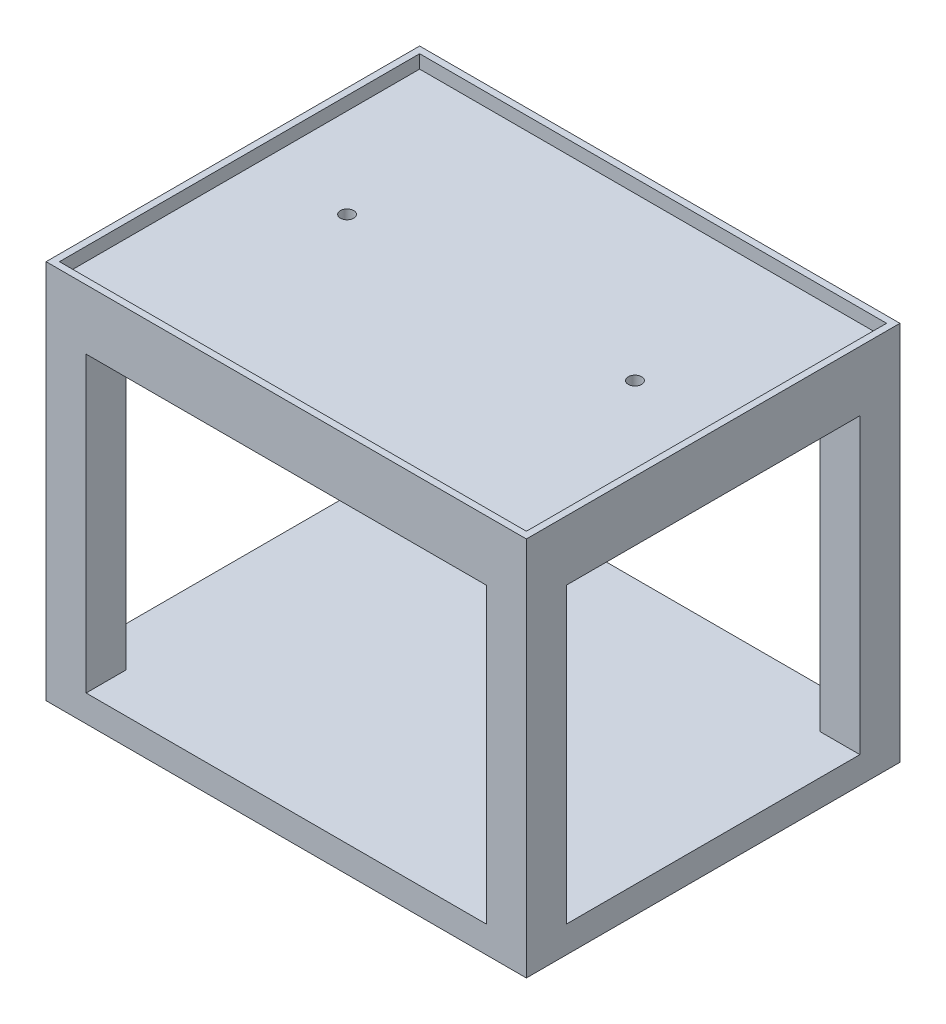
from build123d import *

# Parameters (mm, degrees)
SKETCH1_W                  = 914.4
SKETCH1_H                  = 711.2
BOSS_EXTRUDE1_DEPTH        = 114.3
SKETCH2_W                  = 889
SKETCH2_H                  = 685.8
CUT_EXTRUDE1_DEPTH         = 25.4
SKETCH3_W                  = 76.2
SKETCH3_H                  = 76.2
BOSS_EXTRUDE2_DEPTH        = 609.6
SKETCH4_W                  = 914.4
SKETCH4_H                  = 711.2
BOSS_EXTRUDE3_DEPTH        = 50.8
F_1_1_DIAMETER_HOLE1_D     = 25.4
F_1_1_DIAMETER_HOLE1_DEPTH = 88.9


with BuildPart() as part:
    # Sketch1 → Boss-Extrude1 (new body)
    with BuildSketch(Plane(origin=(0, 0, 0), x_dir=(1, 0, 0), z_dir=(0, 1, 0))):
        Rectangle(SKETCH1_W, SKETCH1_H)
    extrude(amount=BOSS_EXTRUDE1_DEPTH)

    # Sketch2 → Cut-Extrude1 (cut)
    with BuildSketch(Plane(origin=(0, 114.3, 0), x_dir=(1, 0, 0), z_dir=(0, 1, 0))):
        Rectangle(SKETCH2_W, SKETCH2_H)
    extrude(amount=-CUT_EXTRUDE1_DEPTH, mode=Mode.SUBTRACT)

    # Sketch3 → Boss-Extrude2 (add)
    with BuildSketch(Plane.XZ):
        with Locations((-419.1, 317.5)):
            Rectangle(SKETCH3_W, SKETCH3_H)
        with Locations((419.1, 317.5)):
            Rectangle(SKETCH3_W, SKETCH3_H)
        with Locations((419.1, -317.5)):
            Rectangle(SKETCH3_W, SKETCH3_H)
        with Locations((-419.1, -317.5)):
            Rectangle(SKETCH3_W, SKETCH3_H)
    extrude(amount=BOSS_EXTRUDE2_DEPTH)

    # Sketch4 → Boss-Extrude3 (add)
    with BuildSketch(Plane.XZ.offset(609.6)):
        Rectangle(SKETCH4_W, SKETCH4_H)
    extrude(amount=-BOSS_EXTRUDE3_DEPTH)

    # 1 (1) Diameter Hole1
    with Locations(Plane(origin=(0, 88.9, 0), x_dir=(1, 0, 0), z_dir=(0, 1, 0))):
        with Locations((-274.028125044, 34.29999998), (274.028125044, 34.29999998)):
            Hole(F_1_1_DIAMETER_HOLE1_D / 2, depth=F_1_1_DIAMETER_HOLE1_DEPTH)


solid = part.part
